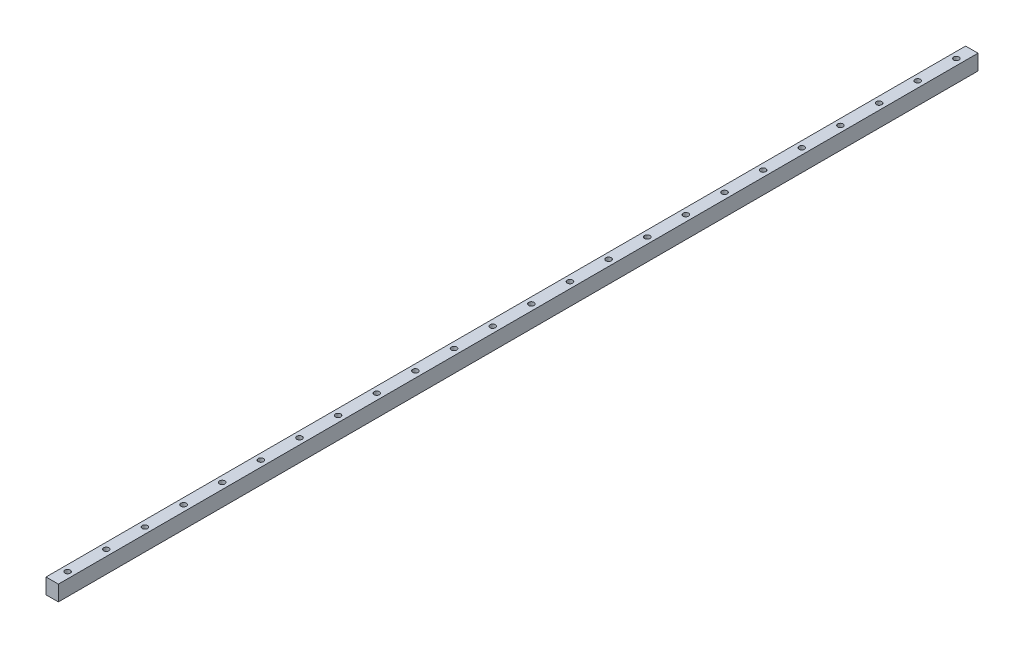
from build123d import *

# Parameters (mm, degrees)
SKETCH1_W           = 8
SKETCH1_H           = 10
BOSS_EXTRUDE1_DEPTH = 595
SKETCH2_R           = 1.75
CUT_EXTRUDE1_DEPTH  = 596.097471008
LPATTERN1_COUNT     = 24
LPATTERN1_PITCH     = 25


with BuildPart() as part:
    # Sketch1 → Boss-Extrude1 (new body)
    with BuildSketch(Plane.XY):
        Rectangle(SKETCH1_W, SKETCH1_H)
    extrude(amount=BOSS_EXTRUDE1_DEPTH)

    # Sketch2 → Cut-Extrude1 (cut, through all)
    with BuildSketch(Plane(origin=(0, 5, 0), x_dir=(1, 0, 0), z_dir=(0, 1, 0))):
        with Locations(Location((0, -10, 0), (0, 0, 270))):
            Circle(SKETCH2_R)
    cut_extrude1 = extrude(amount=-CUT_EXTRUDE1_DEPTH, mode=Mode.SUBTRACT)

    # LPattern1: Cut-Extrude1 ×24
    with Locations(*[(0, 0, i * LPATTERN1_PITCH) for i in range(1, LPATTERN1_COUNT)]):
        add(cut_extrude1, mode=Mode.SUBTRACT)


solid = part.part
